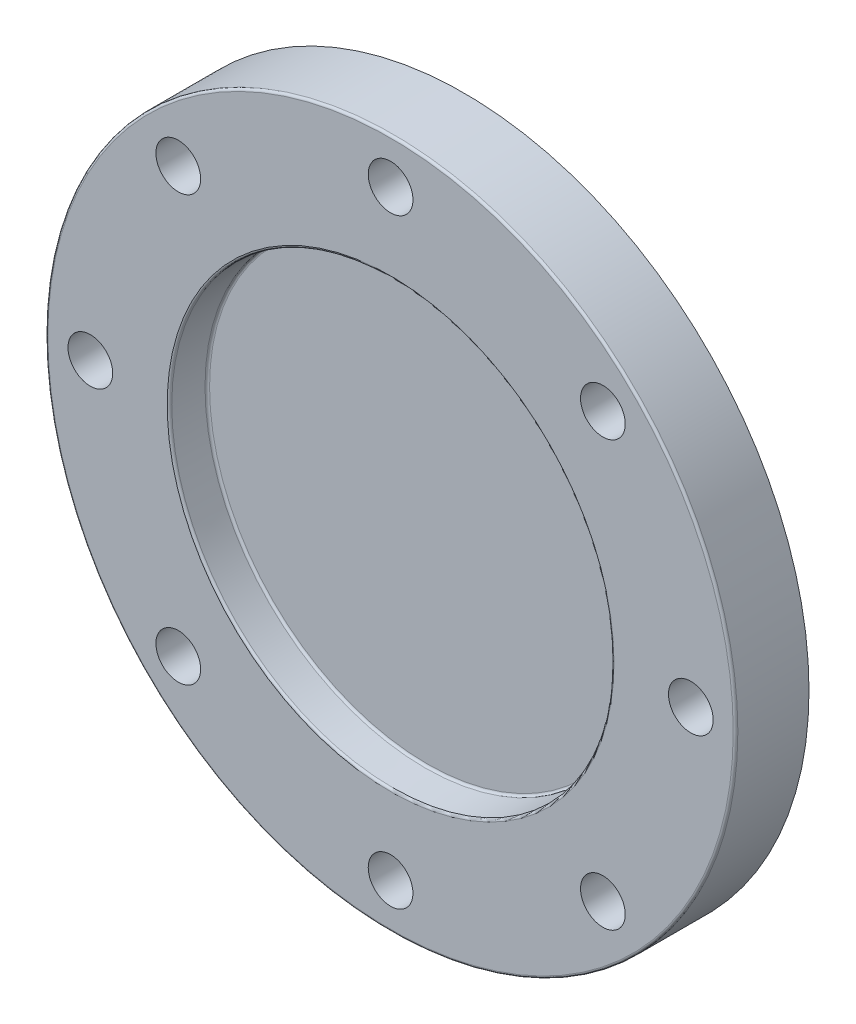
from build123d import *

# Parameters (mm, degrees)
SKETCH1_R         = 171.45
EXTRUDE1_DEPTH    = 36.5125
SKETCH2_R         = 11.1125
EXTRUDE2_DEPTH    = 246.20066814
CIRPATTERN1_COUNT = 8
FILLET1_R         = 1.154545455


with BuildPart() as part:
    # Sketch1 → Extrude1 (new body)
    with BuildSketch(Plane.XY):
        Circle(SKETCH1_R)
    extrude(amount=EXTRUDE1_DEPTH)

    # Sketch2 → Extrude2 (cut, through all)
    with BuildSketch(Plane.XY.offset(36.5125)):
        with Locations((0, 149.225)):
            Circle(SKETCH2_R)
    extrude2 = extrude(amount=-EXTRUDE2_DEPTH, mode=Mode.SUBTRACT)

    # CirPattern1: Extrude2 ×8 about axis
    cirpattern1_axis = Axis((0, 0, 0), (0, 0, 1))
    for i in range(1, CIRPATTERN1_COUNT):
        add(extrude2.rotate(cirpattern1_axis, i * 360 / CIRPATTERN1_COUNT), mode=Mode.SUBTRACT)

    # Sketch3 → Cut-Revolve1 (revolve, cut)
    with BuildSketch(Plane(origin=(0, 0, 0), x_dir=(0, 0, -1), z_dir=(1, 0, 0))):
        Polygon((-36.5125, 109.9185), (-18.25625, 109.347), (-18.25625, 0), (-36.5125, 0), align=None)
    revolve(axis=Axis((0, 0, 18.25625), (0, 0, 1)), mode=Mode.SUBTRACT)

    # Fillet1
    fillet1_edges = [part.edges().sort_by_distance(p)[0] for p in [
        (0, -109.347, 18.25625),
        (0, -109.9185, 36.5125),
        (-171.45, 0, 36.5125),
    ]]
    fillet(fillet1_edges, radius=FILLET1_R)


solid = part.part
